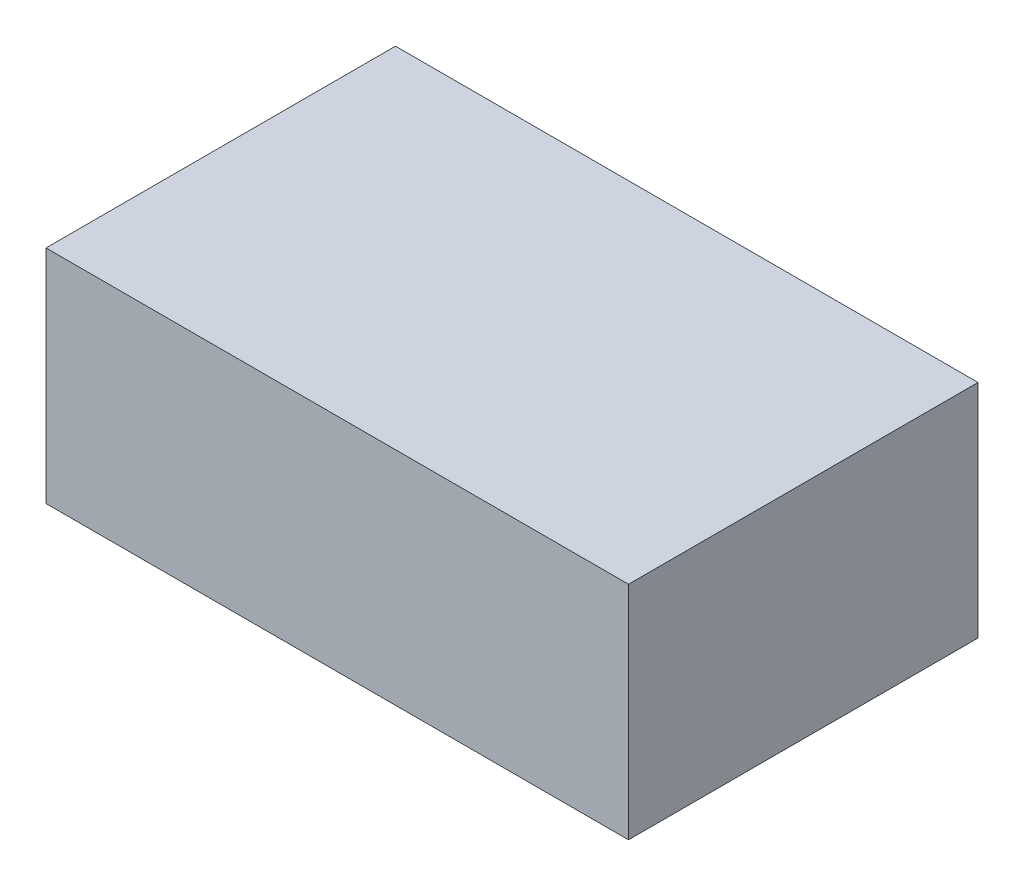
from build123d import *

# Parameters (mm, degrees)
SKETCH1_W           = 50
SKETCH1_H           = 30
BOSS_EXTRUDE1_DEPTH = 19


with BuildPart() as part:
    # Sketch1 → Boss-Extrude1 (new body)
    with BuildSketch(Plane(origin=(0, 0, 0), x_dir=(1, 0, 0), z_dir=(0, 1, 0))):
        Rectangle(SKETCH1_W, SKETCH1_H)
    extrude(amount=BOSS_EXTRUDE1_DEPTH)


solid = part.part
